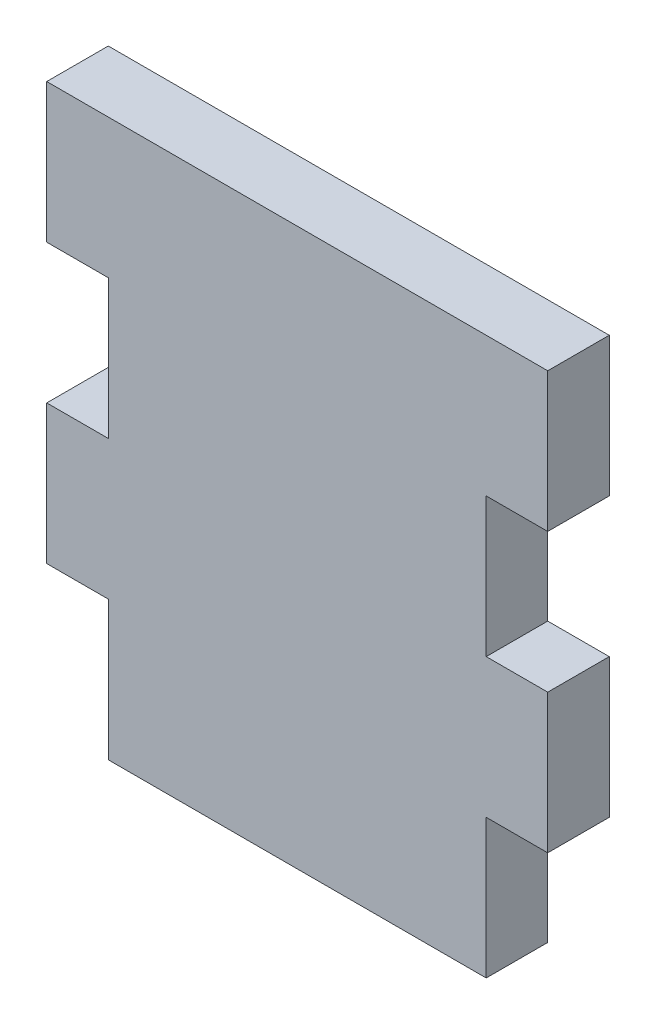
from build123d import *

# Parameters (mm, degrees)
SKETCH1_W           = 43.434
SKETCH1_H           = 48.26
BOSS_EXTRUDE1_DEPTH = 5.334
SKETCH2_W           = 5.334
SKETCH2_H           = 12.065
CUT_EXTRUDE1_DEPTH  = 95.62360518


with BuildPart() as part:
    # Sketch1 → Boss-Extrude1 (new body)
    with BuildSketch(Plane.XY):
        with Locations((-66.368249325, -10.019142782)):
            Rectangle(SKETCH1_W, SKETCH1_H)
    extrude(amount=BOSS_EXTRUDE1_DEPTH)

    # Sketch2 → Cut-Extrude1 (cut, through all)
    with BuildSketch(Plane.XY.offset(5.334)):
        with Locations((-85.418249325, -28.116642782)):
            Rectangle(SKETCH2_W, SKETCH2_H)
        with Locations((-85.418249325, -3.986642782)):
            Rectangle(SKETCH2_W, SKETCH2_H)
        with Locations((-47.318249325, -3.986642782)):
            Rectangle(SKETCH2_W, SKETCH2_H)
        with Locations((-47.318249325, -28.116642782)):
            Rectangle(SKETCH2_W, SKETCH2_H)
    extrude(amount=-CUT_EXTRUDE1_DEPTH, mode=Mode.SUBTRACT)


solid = part.part
